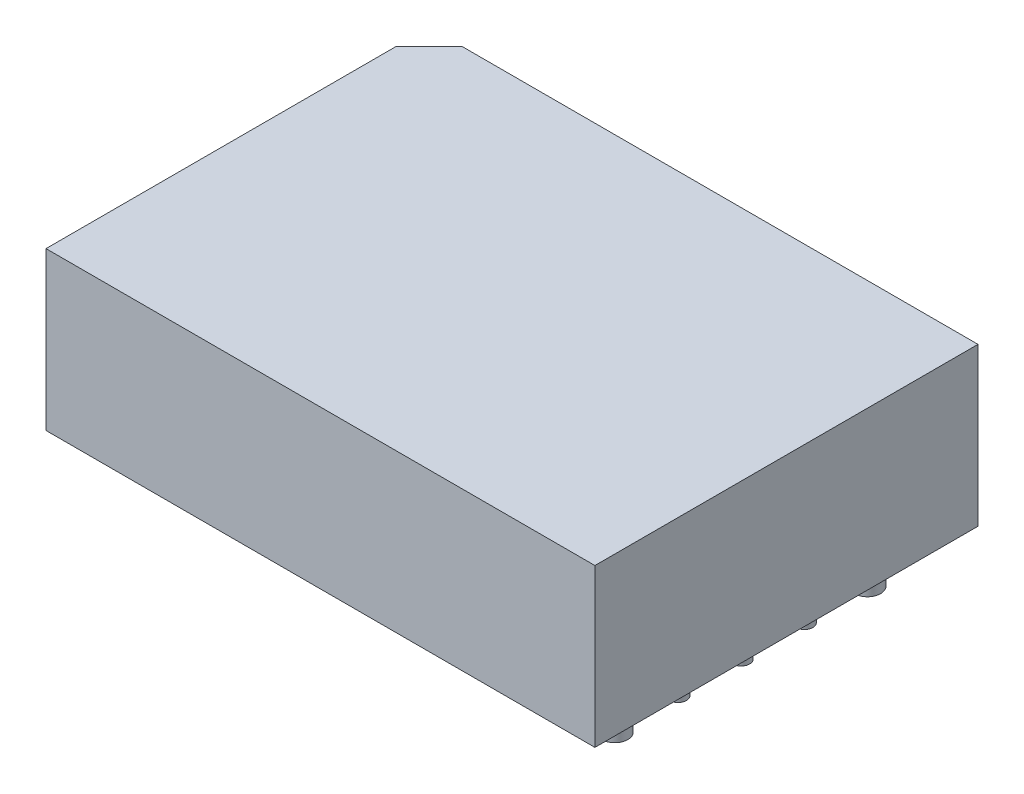
from build123d import *

# Parameters (mm, degrees)
BOSS_EXTRUDE1_DEPTH = 9.5
SKETCH4_R           = 0.785
SKETCH4_R_2         = 0.51
BOSS_EXTRUDE2_DEPTH = 12


with BuildPart() as part:
    # Sketch1 → Boss-Extrude1 (new body)
    with BuildSketch(Plane(origin=(0, 0, 0), x_dir=(1, 0, 0), z_dir=(0, 1, 0))):
        Polygon((-31.1, 23.1), (-33.1, 21.1), (-33.1, 0), (0, 0), (0, 23.1), align=None)
    extrude(amount=BOSS_EXTRUDE1_DEPTH)

    # Sketch4 → Boss-Extrude2 (add)
    # profile 1 of 10: a face of its own
    with BuildSketch(Plane(origin=(0, 9.5, 0), x_dir=(1, 0, 0), z_dir=(0, 1, 0))):
        with Locations(Location((-2.7, 19.14, 0), (0, 0, 270))):
            Circle(SKETCH4_R)
        with Locations((-2.7, 19.14)):
            Circle(SKETCH4_R_2, mode=Mode.SUBTRACT)
    # profile 2 of 10: a face of its own
    with BuildSketch(Plane(origin=(0, 9.5, 0), x_dir=(1, 0, 0), z_dir=(0, 1, 0))):
        with Locations((-2.7, 19.14)):
            Circle(SKETCH4_R_2)
    # profile 3 of 10: a face of its own
    with BuildSketch(Plane(origin=(0, 9.5, 0), x_dir=(1, 0, 0), z_dir=(0, 1, 0))):
        with Locations(Location((-2.7, 15.33, 0), (0, 0, 270))):
            Circle(SKETCH4_R_2)
    # profile 4 of 10: a face of its own
    with BuildSketch(Plane(origin=(0, 9.5, 0), x_dir=(1, 0, 0), z_dir=(0, 1, 0))):
        with Locations(Location((-2.7, 3.9, 0), (0, 0, 270))):
            Circle(SKETCH4_R)
        with Locations((-2.7, 3.9)):
            Circle(SKETCH4_R_2, mode=Mode.SUBTRACT)
    # profile 5 of 10: a face of its own
    with BuildSketch(Plane(origin=(0, 9.5, 0), x_dir=(1, 0, 0), z_dir=(0, 1, 0))):
        with Locations((-2.7, 3.9)):
            Circle(SKETCH4_R_2)
    # profile 6 of 10: a face of its own
    with BuildSketch(Plane(origin=(0, 9.5, 0), x_dir=(1, 0, 0), z_dir=(0, 1, 0))):
        with Locations(Location((-2.7, 7.71, 0), (0, 0, 270))):
            Circle(SKETCH4_R_2)
    # profile 7 of 10: a face of its own
    with BuildSketch(Plane(origin=(0, 9.5, 0), x_dir=(1, 0, 0), z_dir=(0, 1, 0))):
        with Locations(Location((-2.7, 11.52, 0), (0, 0, 270))):
            Circle(SKETCH4_R_2)
    # profile 8 of 10: a face of its own
    with BuildSketch(Plane(origin=(0, 9.5, 0), x_dir=(1, 0, 0), z_dir=(0, 1, 0))):
        with Locations(Location((-30.64, 5.004160149, 0), (0, 0, 270))):
            Circle(SKETCH4_R_2)
    # profile 9 of 10: a face of its own
    with BuildSketch(Plane(origin=(0, 9.5, 0), x_dir=(1, 0, 0), z_dir=(0, 1, 0))):
        with Locations(Location((-30.64, 19.14, 0), (0, 0, 270))):
            Circle(SKETCH4_R_2)
    # profile 10 of 10: a face of its own
    with BuildSketch(Plane(origin=(0, 9.5, 0), x_dir=(1, 0, 0), z_dir=(0, 1, 0))):
        with Locations(Location((-30.64, 11.52, 0), (0, 0, 270))):
            Circle(SKETCH4_R_2)
    extrude(amount=-BOSS_EXTRUDE2_DEPTH)


solid = part.part
